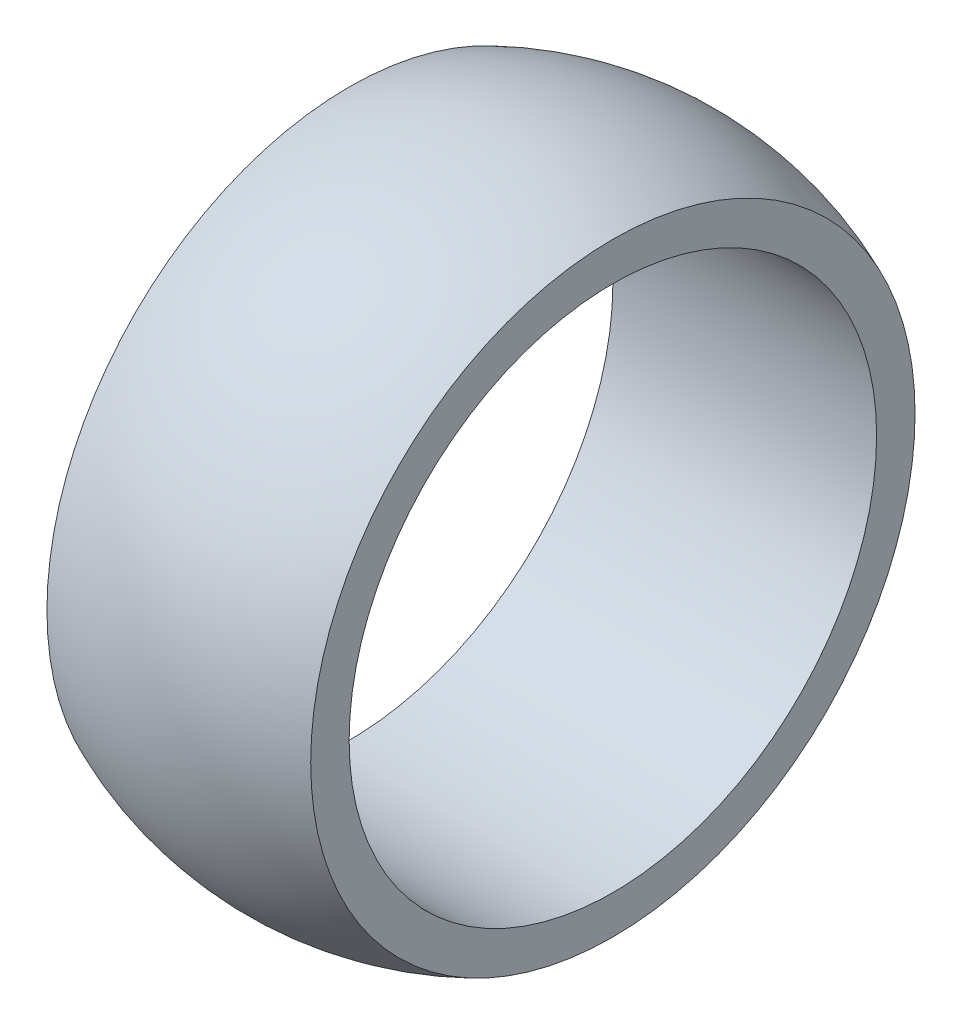
from build123d import *

# Parameters (mm, degrees)
CUT_EXTRUDE1_DEPTH      = 9.844526556
CUT_EXTRUDE1_DEPTH_BACK = 9.844526556
SKETCH2_R               = 2.54
SKETCH3_R               = 3.175
CUT_EXTRUDE2_DEPTH      = 5.08


with BuildPart() as part:
    # Sketch1 → Revolve1 (revolve)
    with BuildSketch(Plane(origin=(0, 0, 0), x_dir=(1, 0, 0), z_dir=(0, 1, 0))):
        with BuildLine():
            Line((0, 3.175), (0, -3.175))
            ThreePointArc((0, -3.175), (-3.175, 0), (0, 3.175))
        make_face()
    revolve(axis=Axis((0, 0, -3.175), (0, 0, 1)))

    # Sketch2 → Cut-Extrude1 (cut, two sides: drawn at the far end of the back side and taken through both)
    with BuildSketch(Plane(origin=(4.445, 0, 0), x_dir=(0, 0, -1), z_dir=(1, 0, 0)).offset(-CUT_EXTRUDE1_DEPTH_BACK)):
        Circle(SKETCH2_R)
    extrude(amount=CUT_EXTRUDE1_DEPTH + CUT_EXTRUDE1_DEPTH_BACK, mode=Mode.SUBTRACT)

    # Sketch3 → Cut-Extrude2 (cut)
    with BuildSketch(Plane(origin=(6.35, 0, 0), x_dir=(0, 0, -1), z_dir=(1, 0, 0))):
        Circle(SKETCH3_R)
    cut_extrude2 = extrude(amount=-CUT_EXTRUDE2_DEPTH, mode=Mode.SUBTRACT)

    # Mirror1: Cut-Extrude2 across plane
    add(cut_extrude2.mirror(Plane(origin=(0, 0, 0), x_dir=(0, 0, 1), z_dir=(1, 0, 0))), mode=Mode.SUBTRACT)


solid = part.part
